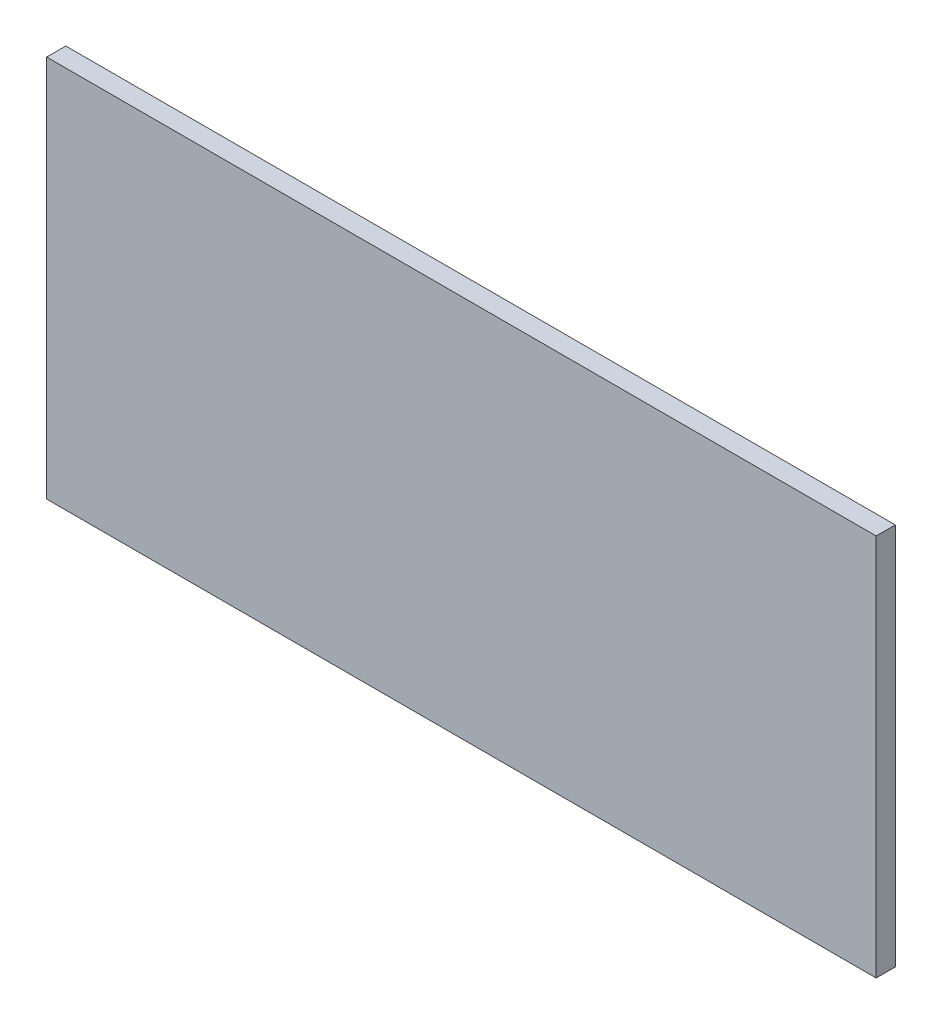
from build123d import *

# Parameters (mm, degrees)
SKETCH1_W           = 65
SKETCH1_H           = 30
BOSS_EXTRUDE1_DEPTH = 1.5
BOSS_EXTRUDE2_DEPTH = 1.5


with BuildPart() as part:
    # Sketch1 → Boss-Extrude1 (new body)
    with BuildSketch(Plane.XY):
        with Locations((97.82, 18.3614)):
            Rectangle(SKETCH1_W, SKETCH1_H)
    extrude(amount=-BOSS_EXTRUDE1_DEPTH)


with BuildPart() as body_2:
    # Sketch2 → Boss-Extrude2 (new body)
    with BuildSketch(Plane(origin=(0, 0, -1.5), x_dir=(-1, 0, 0), z_dir=(0, 0, -1))):
        with BuildLine():
            Line((-120.32, 27.8614), (-75.32, 27.8614))
            ThreePointArc((-75.32, 27.8614), (-73.552233047, 27.129166953), (-72.82, 25.3614))
            Line((-72.82, 25.3614), (-72.82, 11.3614))
            ThreePointArc((-72.82, 11.3614), (-73.552233047, 9.593633047), (-75.32, 8.8614))
            Line((-75.32, 8.8614), (-120.32, 8.8614))
            ThreePointArc((-120.32, 8.8614), (-122.087766953, 9.593633047), (-122.82, 11.3614))
            Line((-122.82, 11.3614), (-122.82, 25.3614))
            ThreePointArc((-122.82, 25.3614), (-122.087766953, 27.129166953), (-120.32, 27.8614))
        make_face()
    extrude(amount=BOSS_EXTRUDE2_DEPTH)


solid = Compound([part.part, body_2.part])
